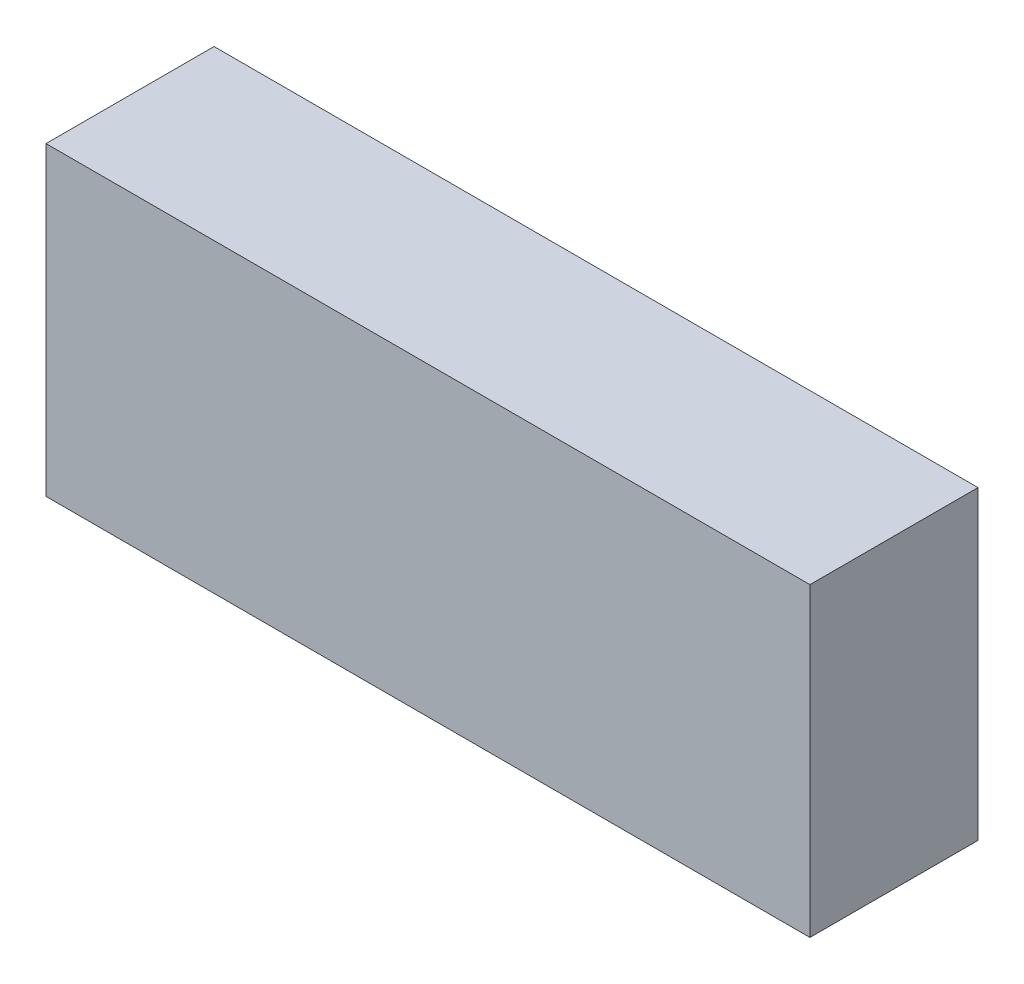
from build123d import *

# Parameters (mm, degrees)
SKETCH1_W           = 100
SKETCH1_H           = 40
BOSS_EXTRUDE1_DEPTH = 22


with BuildPart() as part:
    # Sketch1 → Boss-Extrude1 (new body)
    with BuildSketch(Plane.XY):
        with Locations((50, -20)):
            Rectangle(SKETCH1_W, SKETCH1_H)
    extrude(amount=BOSS_EXTRUDE1_DEPTH)


solid = part.part
